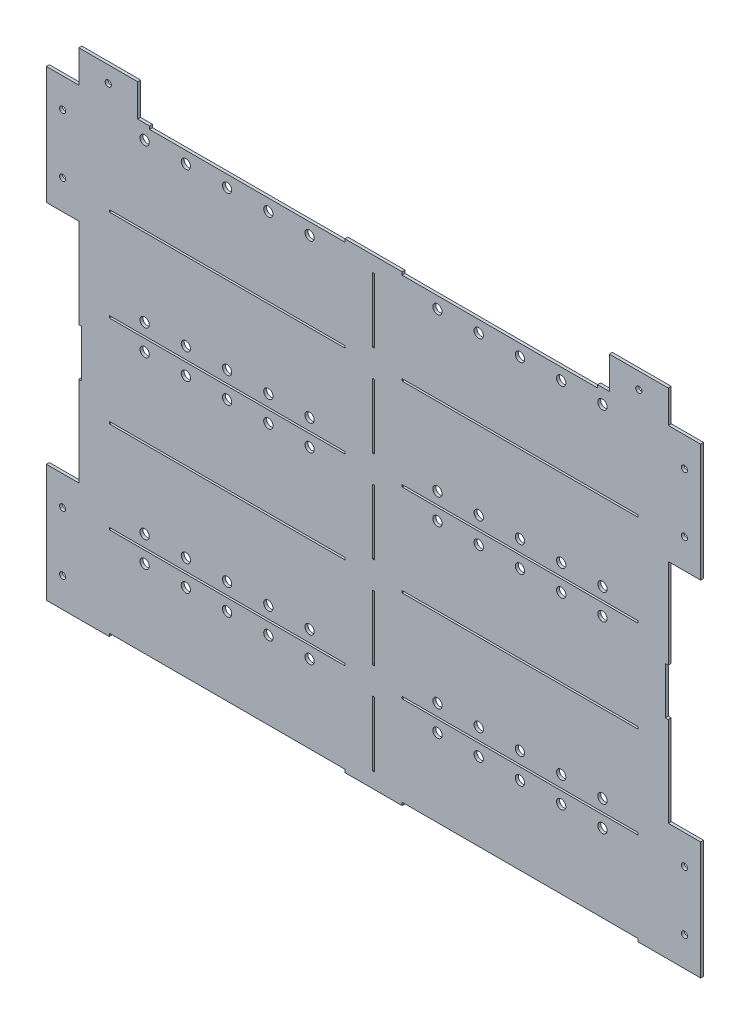
from build123d import *

# Parameters (mm, degrees)
MASTER_SKETCH_W            = 635.3556
MASTER_SKETCH_H            = 498.348
BOSS_EXTRUDE1_DEPTH        = 3.175
SKETCH2_W                  = 34.925
SKETCH2_H                  = 127
BOSS_EXTRUDE2_DEPTH        = 3.175
M6_CLEARANCE_HOLE1_D       = 6.6
MIRROR7_COPY_1_SKETCH_W    = 34.925
MIRROR7_COPY_1_SKETCH_H    = 127
MIRROR7_COPY_1_DEPTH       = 3.175
MIRROR7_COPY_2_D           = 6.6
SKETCH5_W                  = 2.286
SKETCH5_H                  = 69.85
CUT_EXTRUDE1_DEPTH         = 432.771348596
LPATTERN1_COUNT            = 5
LPATTERN1_PITCH            = 98.8568
SKETCH7_W                  = 254
SKETCH7_H                  = 2.286
CUT_EXTRUDE3_DEPTH         = 432.771348596
LPATTERN2_COUNT            = 4
LPATTERN2_PITCH            = 98.8568
MIRROR4_COPY_1_SKETCH_W    = 254
MIRROR4_COPY_1_SKETCH_H    = 2.286
MIRROR4_COPY_1_DEPTH       = 432.771348596
MIRROR4_COPY_2_SKETCH_W    = 254
MIRROR4_COPY_2_SKETCH_H    = 2.286
MIRROR4_COPY_2_DEPTH       = 432.771348596
MIRROR4_COPY_3_SKETCH_W    = 254
MIRROR4_COPY_3_SKETCH_H    = 2.286
MIRROR4_COPY_3_DEPTH       = 432.771348596
SKETCH10_W                 = 63.5
SKETCH10_H                 = 34.925
SKETCH10_R                 = 3
BOSS_EXTRUDE3_DEPTH        = 3.175
M6_CLEARANCE_HOLE2_D       = 6.6
SKETCH6_W                  = 254
SKETCH6_H                  = 3.175
SKETCH6_W_2                = 210.6549
CUT_EXTRUDE2_DEPTH         = 453.825636414
SKETCH15_W                 = 6.35
SKETCH15_H                 = 50.8
CUT_EXTRUDE4_DEPTH         = 453.825636414
SKETCH16_R                 = 5
CUT_EXTRUDE5_DEPTH         = 453.825636414
LPATTERN3_COUNT            = 3
LPATTERN3_PITCH            = 44.45
LPATTERN3_COL_COUNT        = 3
LPATTERN3_COL_PITCH        = 44.45
MIRROR9_COPY_1_SKETCH_R    = 5
MIRROR9_COPY_1_DEPTH       = 453.825636414
MIRROR9_COPY_2_SKETCH_R    = 5
MIRROR9_COPY_2_DEPTH       = 453.825636414
MIRROR9_COPY_3_SKETCH_R    = 5
MIRROR9_COPY_3_DEPTH       = 453.825636414
MIRROR9_COPY_4_SKETCH_R    = 5
MIRROR9_COPY_4_DEPTH       = 453.825636414
MIRROR10_COPY_1_SKETCH_R   = 5
MIRROR10_COPY_1_DEPTH      = 453.825636414
MIRROR10_COPY_2_SKETCH_R   = 5
MIRROR10_COPY_2_DEPTH      = 453.825636414
MIRROR10_COPY_3_SKETCH_R   = 5
MIRROR10_COPY_3_DEPTH      = 453.825636414
MIRROR10_COPY_4_SKETCH_R   = 5
MIRROR10_COPY_4_DEPTH      = 453.825636414
MIRROR10_COPY_5_SKETCH_R   = 5
MIRROR10_COPY_5_DEPTH      = 453.825636414
MIRROR10_COPY_6_SKETCH_R   = 5
MIRROR10_COPY_6_DEPTH      = 453.825636414
MIRROR10_COPY_7_SKETCH_R   = 5
MIRROR10_COPY_7_DEPTH      = 453.825636414
MIRROR10_COPY_8_SKETCH_R   = 5
MIRROR10_COPY_8_DEPTH      = 453.825636414
MIRROR10_COPY_9_SKETCH_R   = 5
MIRROR10_COPY_9_DEPTH      = 453.825636414
LPATTERN4_COUNT            = 2
LPATTERN4_PITCH            = 395.4272
LPATTERN4_COPY_1_SKETCH_R  = 5
LPATTERN4_COPY_1_DEPTH     = 453.825636414
LPATTERN4_COPY_2_SKETCH_R  = 5
LPATTERN4_COPY_2_DEPTH     = 453.825636414
LPATTERN4_COPY_3_SKETCH_R  = 5
LPATTERN4_COPY_3_DEPTH     = 453.825636414
LPATTERN4_COPY_4_SKETCH_R  = 5
LPATTERN4_COPY_4_DEPTH     = 453.825636414
LPATTERN4_COPY_5_SKETCH_R  = 5
LPATTERN4_COPY_5_DEPTH     = 453.825636414
LPATTERN4_COPY_6_SKETCH_R  = 5
LPATTERN4_COPY_6_DEPTH     = 453.825636414
LPATTERN4_COPY_7_SKETCH_R  = 5
LPATTERN4_COPY_7_DEPTH     = 453.825636414
LPATTERN4_COPY_8_SKETCH_R  = 5
LPATTERN4_COPY_8_DEPTH     = 453.825636414
LPATTERN4_COPY_9_SKETCH_R  = 5
LPATTERN4_COPY_9_DEPTH     = 453.825636414
LPATTERN6_COUNT            = 2
LPATTERN6_PITCH            = 197.7136
LPATTERN6_COPY_1_SKETCH_R  = 5
LPATTERN6_COPY_1_DEPTH     = 453.825636414
LPATTERN6_COPY_2_SKETCH_R  = 5
LPATTERN6_COPY_2_DEPTH     = 453.825636414
LPATTERN6_COPY_3_SKETCH_R  = 5
LPATTERN6_COPY_3_DEPTH     = 453.825636414
LPATTERN6_COPY_4_SKETCH_R  = 5
LPATTERN6_COPY_4_DEPTH     = 453.825636414
LPATTERN6_COPY_5_SKETCH_R  = 5
LPATTERN6_COPY_5_DEPTH     = 453.825636414
LPATTERN6_COPY_6_SKETCH_R  = 5
LPATTERN6_COPY_6_DEPTH     = 453.825636414
LPATTERN6_COPY_7_SKETCH_R  = 5
LPATTERN6_COPY_7_DEPTH     = 453.825636414
LPATTERN6_COPY_8_SKETCH_R  = 5
LPATTERN6_COPY_8_DEPTH     = 453.825636414
LPATTERN6_COPY_9_SKETCH_R  = 5
LPATTERN6_COPY_9_DEPTH     = 453.825636414
LPATTERN6_COPY_10_SKETCH_R = 5
LPATTERN6_COPY_10_DEPTH    = 453.825636414
LPATTERN6_COPY_11_SKETCH_R = 5
LPATTERN6_COPY_11_DEPTH    = 453.825636414
LPATTERN6_COPY_12_SKETCH_R = 5
LPATTERN6_COPY_12_DEPTH    = 453.825636414
LPATTERN6_COPY_13_SKETCH_R = 5
LPATTERN6_COPY_13_DEPTH    = 453.825636414
LPATTERN6_COPY_14_SKETCH_R = 5
LPATTERN6_COPY_14_DEPTH    = 453.825636414
LPATTERN6_COPY_15_SKETCH_R = 5
LPATTERN6_COPY_15_DEPTH    = 453.825636414
LPATTERN6_COPY_16_SKETCH_R = 5
LPATTERN6_COPY_16_DEPTH    = 453.825636414
LPATTERN6_COPY_17_SKETCH_R = 5
LPATTERN6_COPY_17_DEPTH    = 453.825636414
LPATTERN6_COPY_18_SKETCH_R = 5
LPATTERN6_COPY_18_DEPTH    = 453.825636414
LPATTERN6_COPY_19_SKETCH_R = 5
LPATTERN6_COPY_19_DEPTH    = 453.825636414


with BuildPart() as part:
    # Master Sketch → Boss-Extrude1 (new body)
    with BuildSketch(Plane.XY):
        Rectangle(MASTER_SKETCH_W, MASTER_SKETCH_H)
    extrude(amount=BOSS_EXTRUDE1_DEPTH)

    # Sketch2 → Boss-Extrude2 (add)
    with BuildSketch(Plane.XY.offset(3.175)):
        with Locations((-335.1403, -185.674)):
            Rectangle(SKETCH2_W, SKETCH2_H)
    boss_extrude2 = extrude(amount=-BOSS_EXTRUDE2_DEPTH)

    # M6 Clearance Hole1 (through all)
    with Locations(Plane.XY.offset(3.175)):
        with Locations((-335.1403, -217.424), (-335.1403, -153.924)):
            m6_clearance_hole1 = Hole(M6_CLEARANCE_HOLE1_D / 2)

    # Mirror1: Boss-Extrude2, M6 Clearance Hole1 across plane
    add(boss_extrude2.mirror(Plane(origin=(0, 0, 0), x_dir=(0, 0, 1), z_dir=(1, 0, 0))))
    add(m6_clearance_hole1.mirror(Plane(origin=(0, 0, 0), x_dir=(0, 0, 1), z_dir=(1, 0, 0))), mode=Mode.SUBTRACT)

    # Mirror7: Boss-Extrude2, M6 Clearance Hole1 across plane
    add(boss_extrude2.mirror(Plane.ZX))
    add(m6_clearance_hole1.mirror(Plane.ZX), mode=Mode.SUBTRACT)

    # Mirror7 copy 1 sketch → Mirror7 copy 1 (add)
    with BuildSketch(Plane(origin=(0, 0, 3.175), x_dir=(-1, 0, 0), z_dir=(0, 0, 1))):
        with Locations((-335.1403, -185.674)):
            Rectangle(MIRROR7_COPY_1_SKETCH_W, MIRROR7_COPY_1_SKETCH_H)
    extrude(amount=-MIRROR7_COPY_1_DEPTH)

    # Mirror7 copy 2 (through all)
    with Locations(Plane(origin=(0, 0, 3.175), x_dir=(-1, 0, 0), z_dir=(0, 0, 1))):
        with Locations((-335.1403, -217.424), (-335.1403, -153.924)):
            Hole(MIRROR7_COPY_2_D / 2)

    # Sketch5 → Cut-Extrude1 (cut, through all)
    with BuildSketch(Plane.XY.offset(3.175)):
        with Locations((0, 197.7136)):
            Rectangle(SKETCH5_W, SKETCH5_H)
    cut_extrude1 = extrude(amount=-CUT_EXTRUDE1_DEPTH, mode=Mode.SUBTRACT)

    # LPattern1: Cut-Extrude1 ×5
    with Locations(*[(0, -i * LPATTERN1_PITCH, 0) for i in range(1, LPATTERN1_COUNT)]):
        add(cut_extrude1, mode=Mode.SUBTRACT)

    # Sketch7 → Cut-Extrude3 (cut, through all)
    with BuildSketch(Plane.XY.offset(3.175)):
        with Locations((-157.8229, 148.2852)):
            Rectangle(SKETCH7_W, SKETCH7_H)
    cut_extrude3 = extrude(amount=-CUT_EXTRUDE3_DEPTH, mode=Mode.SUBTRACT)

    # LPattern2: Cut-Extrude3 ×4
    with Locations(*[(0, -i * LPATTERN2_PITCH, 0) for i in range(1, LPATTERN2_COUNT)]):
        add(cut_extrude3, mode=Mode.SUBTRACT)

    # Mirror4: Cut-Extrude3 across plane
    add(cut_extrude3.mirror(Plane(origin=(0, 0, 0), x_dir=(0, 0, 1), z_dir=(1, 0, 0))), mode=Mode.SUBTRACT)

    # Mirror4 copy 1 sketch → Mirror4 copy 1 (cut, through all)
    with BuildSketch(Plane(origin=(0, -98.8568, 3.175), x_dir=(-1, 0, 0), z_dir=(0, 0, 1))):
        with Locations((-157.8229, -148.2852)):
            Rectangle(MIRROR4_COPY_1_SKETCH_W, MIRROR4_COPY_1_SKETCH_H)
    extrude(amount=-MIRROR4_COPY_1_DEPTH, mode=Mode.SUBTRACT)

    # Mirror4 copy 2 sketch → Mirror4 copy 2 (cut, through all)
    with BuildSketch(Plane(origin=(0, -197.7136, 3.175), x_dir=(-1, 0, 0), z_dir=(0, 0, 1))):
        with Locations((-157.8229, -148.2852)):
            Rectangle(MIRROR4_COPY_2_SKETCH_W, MIRROR4_COPY_2_SKETCH_H)
    extrude(amount=-MIRROR4_COPY_2_DEPTH, mode=Mode.SUBTRACT)

    # Mirror4 copy 3 sketch → Mirror4 copy 3 (cut, through all)
    with BuildSketch(Plane(origin=(0, -296.5704, 3.175), x_dir=(-1, 0, 0), z_dir=(0, 0, 1))):
        with Locations((-157.8229, -148.2852)):
            Rectangle(MIRROR4_COPY_3_SKETCH_W, MIRROR4_COPY_3_SKETCH_H)
    extrude(amount=-MIRROR4_COPY_3_DEPTH, mode=Mode.SUBTRACT)

    # Sketch10 → Boss-Extrude3 (add)
    with BuildSketch(Plane.XY.offset(3.175)):
        with Locations((-285.9278, 266.6365)):
            Rectangle(SKETCH10_W, SKETCH10_H)
        with Locations((-285.9278, 266.6365)):
            Circle(SKETCH10_R, mode=Mode.SUBTRACT)
    boss_extrude3 = extrude(amount=-BOSS_EXTRUDE3_DEPTH)

    # M6 Clearance Hole2 (through all)
    with Locations(Plane.XY.offset(3.175)):
        with Locations((-285.9278, 266.6365)):
            m6_clearance_hole2 = Hole(M6_CLEARANCE_HOLE2_D / 2)

    # Mirror6: Boss-Extrude3, M6 Clearance Hole2 across plane
    add(boss_extrude3.mirror(Plane(origin=(0, 0, 0), x_dir=(0, 0, 1), z_dir=(1, 0, 0))))
    add(m6_clearance_hole2.mirror(Plane(origin=(0, 0, 0), x_dir=(0, 0, 1), z_dir=(1, 0, 0))), mode=Mode.SUBTRACT)

    # Sketch6 → Cut-Extrude2 (cut, through all)
    with BuildSketch(Plane.XY.offset(3.175)):
        with Locations((-157.8229, -247.5865)):
            Rectangle(SKETCH6_W, SKETCH6_H)
        with Locations((157.8229, -247.5865)):
            Rectangle(SKETCH6_W, SKETCH6_H)
        with Locations((-136.15035, 247.5865)):
            Rectangle(SKETCH6_W_2, SKETCH6_H)
        with Locations((136.15035, 247.5865)):
            Rectangle(SKETCH6_W_2, SKETCH6_H)
    extrude(amount=-CUT_EXTRUDE2_DEPTH, mode=Mode.SUBTRACT)

    # Sketch15 → Cut-Extrude4 (cut, through all)
    with BuildSketch(Plane(origin=(0, 0, 0), x_dir=(-1, 0, 0), z_dir=(0, 0, -1))):
        with Locations((317.6778, 0)):
            Rectangle(SKETCH15_W, SKETCH15_H)
    cut_extrude4 = extrude(amount=-CUT_EXTRUDE4_DEPTH, mode=Mode.SUBTRACT)

    # Mirror8: Cut-Extrude4 across plane
    add(cut_extrude4.mirror(Plane(origin=(0, 0, 0), x_dir=(0, 0, 1), z_dir=(1, 0, 0))), mode=Mode.SUBTRACT)

    # Sketch16 → Cut-Extrude5 (cut, through all)
    with BuildSketch(Plane(origin=(0, 0, 0), x_dir=(-1, 0, 0), z_dir=(0, 0, -1))):
        with Locations((-157.8229, -162.1282)):
            Circle(SKETCH16_R)
    cut_extrude5 = extrude(amount=-CUT_EXTRUDE5_DEPTH, mode=Mode.SUBTRACT)

    # LPattern3: Cut-Extrude5 ×3
    with Locations(*[(i * LPATTERN3_PITCH, 0, 0) for i in range(1, LPATTERN3_COUNT)]):
        add(cut_extrude5, mode=Mode.SUBTRACT)

    # LPattern3 col: Cut-Extrude5 ×3
    with Locations(*[(-i * LPATTERN3_COL_PITCH, 0, 0) for i in range(1, LPATTERN3_COL_COUNT)]):
        add(cut_extrude5, mode=Mode.SUBTRACT)

    # Mirror9: Cut-Extrude5 across plane
    add(cut_extrude5.mirror(Plane(origin=(0, 0, 0), x_dir=(0, 0, 1), z_dir=(1, 0, 0))), mode=Mode.SUBTRACT)

    # Mirror9 copy 1 sketch → Mirror9 copy 1 (cut, through all)
    with BuildSketch(Plane(origin=(-44.45, 0, 0), x_dir=(1, 0, 0), z_dir=(0, 0, -1))):
        with Locations((-157.8229, 162.1282)):
            Circle(MIRROR9_COPY_1_SKETCH_R)
    extrude(amount=-MIRROR9_COPY_1_DEPTH, mode=Mode.SUBTRACT)

    # Mirror9 copy 2 sketch → Mirror9 copy 2 (cut, through all)
    with BuildSketch(Plane(origin=(-88.9, 0, 0), x_dir=(1, 0, 0), z_dir=(0, 0, -1))):
        with Locations((-157.8229, 162.1282)):
            Circle(MIRROR9_COPY_2_SKETCH_R)
    extrude(amount=-MIRROR9_COPY_2_DEPTH, mode=Mode.SUBTRACT)

    # Mirror9 copy 3 sketch → Mirror9 copy 3 (cut, through all)
    with BuildSketch(Plane(origin=(44.45, 0, 0), x_dir=(1, 0, 0), z_dir=(0, 0, -1))):
        with Locations((-157.8229, 162.1282)):
            Circle(MIRROR9_COPY_3_SKETCH_R)
    extrude(amount=-MIRROR9_COPY_3_DEPTH, mode=Mode.SUBTRACT)

    # Mirror9 copy 4 sketch → Mirror9 copy 4 (cut, through all)
    with BuildSketch(Plane(origin=(88.9, 0, 0), x_dir=(1, 0, 0), z_dir=(0, 0, -1))):
        with Locations((-157.8229, 162.1282)):
            Circle(MIRROR9_COPY_4_SKETCH_R)
    extrude(amount=-MIRROR9_COPY_4_DEPTH, mode=Mode.SUBTRACT)

    # Mirror10: Cut-Extrude5 across plane
    add(cut_extrude5.mirror(Plane.ZX.offset(-148.2852)), mode=Mode.SUBTRACT)

    # Mirror10 copy 1 sketch → Mirror10 copy 1 (cut, through all)
    with BuildSketch(Plane(origin=(44.45, -296.5704, 0), x_dir=(-1, 0, 0), z_dir=(0, 0, -1))):
        with Locations((-157.8229, 162.1282)):
            Circle(MIRROR10_COPY_1_SKETCH_R)
    extrude(amount=-MIRROR10_COPY_1_DEPTH, mode=Mode.SUBTRACT)

    # Mirror10 copy 2 sketch → Mirror10 copy 2 (cut, through all)
    with BuildSketch(Plane(origin=(88.9, -296.5704, 0), x_dir=(-1, 0, 0), z_dir=(0, 0, -1))):
        with Locations((-157.8229, 162.1282)):
            Circle(MIRROR10_COPY_2_SKETCH_R)
    extrude(amount=-MIRROR10_COPY_2_DEPTH, mode=Mode.SUBTRACT)

    # Mirror10 copy 3 sketch → Mirror10 copy 3 (cut, through all)
    with BuildSketch(Plane(origin=(-44.45, -296.5704, 0), x_dir=(-1, 0, 0), z_dir=(0, 0, -1))):
        with Locations((-157.8229, 162.1282)):
            Circle(MIRROR10_COPY_3_SKETCH_R)
    extrude(amount=-MIRROR10_COPY_3_DEPTH, mode=Mode.SUBTRACT)

    # Mirror10 copy 4 sketch → Mirror10 copy 4 (cut, through all)
    with BuildSketch(Plane(origin=(-88.9, -296.5704, 0), x_dir=(-1, 0, 0), z_dir=(0, 0, -1))):
        with Locations((-157.8229, 162.1282)):
            Circle(MIRROR10_COPY_4_SKETCH_R)
    extrude(amount=-MIRROR10_COPY_4_DEPTH, mode=Mode.SUBTRACT)

    # Mirror10 copy 5 sketch → Mirror10 copy 5 (cut, through all)
    with BuildSketch(Plane(origin=(0, -296.5704, 0), x_dir=(1, 0, 0), z_dir=(0, 0, -1))):
        with Locations((-157.8229, -162.1282)):
            Circle(MIRROR10_COPY_5_SKETCH_R)
    extrude(amount=-MIRROR10_COPY_5_DEPTH, mode=Mode.SUBTRACT)

    # Mirror10 copy 6 sketch → Mirror10 copy 6 (cut, through all)
    with BuildSketch(Plane(origin=(-44.45, -296.5704, 0), x_dir=(1, 0, 0), z_dir=(0, 0, -1))):
        with Locations((-157.8229, -162.1282)):
            Circle(MIRROR10_COPY_6_SKETCH_R)
    extrude(amount=-MIRROR10_COPY_6_DEPTH, mode=Mode.SUBTRACT)

    # Mirror10 copy 7 sketch → Mirror10 copy 7 (cut, through all)
    with BuildSketch(Plane(origin=(-88.9, -296.5704, 0), x_dir=(1, 0, 0), z_dir=(0, 0, -1))):
        with Locations((-157.8229, -162.1282)):
            Circle(MIRROR10_COPY_7_SKETCH_R)
    extrude(amount=-MIRROR10_COPY_7_DEPTH, mode=Mode.SUBTRACT)

    # Mirror10 copy 8 sketch → Mirror10 copy 8 (cut, through all)
    with BuildSketch(Plane(origin=(44.45, -296.5704, 0), x_dir=(1, 0, 0), z_dir=(0, 0, -1))):
        with Locations((-157.8229, -162.1282)):
            Circle(MIRROR10_COPY_8_SKETCH_R)
    extrude(amount=-MIRROR10_COPY_8_DEPTH, mode=Mode.SUBTRACT)

    # Mirror10 copy 9 sketch → Mirror10 copy 9 (cut, through all)
    with BuildSketch(Plane(origin=(88.9, -296.5704, 0), x_dir=(1, 0, 0), z_dir=(0, 0, -1))):
        with Locations((-157.8229, -162.1282)):
            Circle(MIRROR10_COPY_9_SKETCH_R)
    extrude(amount=-MIRROR10_COPY_9_DEPTH, mode=Mode.SUBTRACT)

    # LPattern4: Cut-Extrude5 ×2
    with Locations(*[(0, i * LPATTERN4_PITCH, 0) for i in range(1, LPATTERN4_COUNT)]):
        add(cut_extrude5, mode=Mode.SUBTRACT)

    # LPattern4 copy 1 sketch → LPattern4 copy 1 (cut, through all)
    with BuildSketch(Plane(origin=(44.45, 395.4272, 0), x_dir=(-1, 0, 0), z_dir=(0, 0, -1))):
        with Locations((-157.8229, -162.1282)):
            Circle(LPATTERN4_COPY_1_SKETCH_R)
    extrude(amount=-LPATTERN4_COPY_1_DEPTH, mode=Mode.SUBTRACT)

    # LPattern4 copy 2 sketch → LPattern4 copy 2 (cut, through all)
    with BuildSketch(Plane(origin=(88.9, 395.4272, 0), x_dir=(-1, 0, 0), z_dir=(0, 0, -1))):
        with Locations((-157.8229, -162.1282)):
            Circle(LPATTERN4_COPY_2_SKETCH_R)
    extrude(amount=-LPATTERN4_COPY_2_DEPTH, mode=Mode.SUBTRACT)

    # LPattern4 copy 3 sketch → LPattern4 copy 3 (cut, through all)
    with BuildSketch(Plane(origin=(-44.45, 395.4272, 0), x_dir=(-1, 0, 0), z_dir=(0, 0, -1))):
        with Locations((-157.8229, -162.1282)):
            Circle(LPATTERN4_COPY_3_SKETCH_R)
    extrude(amount=-LPATTERN4_COPY_3_DEPTH, mode=Mode.SUBTRACT)

    # LPattern4 copy 4 sketch → LPattern4 copy 4 (cut, through all)
    with BuildSketch(Plane(origin=(-88.9, 395.4272, 0), x_dir=(-1, 0, 0), z_dir=(0, 0, -1))):
        with Locations((-157.8229, -162.1282)):
            Circle(LPATTERN4_COPY_4_SKETCH_R)
    extrude(amount=-LPATTERN4_COPY_4_DEPTH, mode=Mode.SUBTRACT)

    # LPattern4 copy 5 sketch → LPattern4 copy 5 (cut, through all)
    with BuildSketch(Plane(origin=(0, 395.4272, 0), x_dir=(1, 0, 0), z_dir=(0, 0, -1))):
        with Locations((-157.8229, 162.1282)):
            Circle(LPATTERN4_COPY_5_SKETCH_R)
    extrude(amount=-LPATTERN4_COPY_5_DEPTH, mode=Mode.SUBTRACT)

    # LPattern4 copy 6 sketch → LPattern4 copy 6 (cut, through all)
    with BuildSketch(Plane(origin=(-44.45, 395.4272, 0), x_dir=(1, 0, 0), z_dir=(0, 0, -1))):
        with Locations((-157.8229, 162.1282)):
            Circle(LPATTERN4_COPY_6_SKETCH_R)
    extrude(amount=-LPATTERN4_COPY_6_DEPTH, mode=Mode.SUBTRACT)

    # LPattern4 copy 7 sketch → LPattern4 copy 7 (cut, through all)
    with BuildSketch(Plane(origin=(-88.9, 395.4272, 0), x_dir=(1, 0, 0), z_dir=(0, 0, -1))):
        with Locations((-157.8229, 162.1282)):
            Circle(LPATTERN4_COPY_7_SKETCH_R)
    extrude(amount=-LPATTERN4_COPY_7_DEPTH, mode=Mode.SUBTRACT)

    # LPattern4 copy 8 sketch → LPattern4 copy 8 (cut, through all)
    with BuildSketch(Plane(origin=(44.45, 395.4272, 0), x_dir=(1, 0, 0), z_dir=(0, 0, -1))):
        with Locations((-157.8229, 162.1282)):
            Circle(LPATTERN4_COPY_8_SKETCH_R)
    extrude(amount=-LPATTERN4_COPY_8_DEPTH, mode=Mode.SUBTRACT)

    # LPattern4 copy 9 sketch → LPattern4 copy 9 (cut, through all)
    with BuildSketch(Plane(origin=(88.9, 395.4272, 0), x_dir=(1, 0, 0), z_dir=(0, 0, -1))):
        with Locations((-157.8229, 162.1282)):
            Circle(LPATTERN4_COPY_9_SKETCH_R)
    extrude(amount=-LPATTERN4_COPY_9_DEPTH, mode=Mode.SUBTRACT)

    # LPattern6: Cut-Extrude5 ×2
    with Locations(*[(0, i * LPATTERN6_PITCH, 0) for i in range(1, LPATTERN6_COUNT)]):
        add(cut_extrude5, mode=Mode.SUBTRACT)

    # LPattern6 copy 1 sketch → LPattern6 copy 1 (cut, through all)
    with BuildSketch(Plane(origin=(44.45, 197.7136, 0), x_dir=(-1, 0, 0), z_dir=(0, 0, -1))):
        with Locations((-157.8229, -162.1282)):
            Circle(LPATTERN6_COPY_1_SKETCH_R)
    extrude(amount=-LPATTERN6_COPY_1_DEPTH, mode=Mode.SUBTRACT)

    # LPattern6 copy 2 sketch → LPattern6 copy 2 (cut, through all)
    with BuildSketch(Plane(origin=(88.9, 197.7136, 0), x_dir=(-1, 0, 0), z_dir=(0, 0, -1))):
        with Locations((-157.8229, -162.1282)):
            Circle(LPATTERN6_COPY_2_SKETCH_R)
    extrude(amount=-LPATTERN6_COPY_2_DEPTH, mode=Mode.SUBTRACT)

    # LPattern6 copy 3 sketch → LPattern6 copy 3 (cut, through all)
    with BuildSketch(Plane(origin=(-44.45, 197.7136, 0), x_dir=(-1, 0, 0), z_dir=(0, 0, -1))):
        with Locations((-157.8229, -162.1282)):
            Circle(LPATTERN6_COPY_3_SKETCH_R)
    extrude(amount=-LPATTERN6_COPY_3_DEPTH, mode=Mode.SUBTRACT)

    # LPattern6 copy 4 sketch → LPattern6 copy 4 (cut, through all)
    with BuildSketch(Plane(origin=(-88.9, 197.7136, 0), x_dir=(-1, 0, 0), z_dir=(0, 0, -1))):
        with Locations((-157.8229, -162.1282)):
            Circle(LPATTERN6_COPY_4_SKETCH_R)
    extrude(amount=-LPATTERN6_COPY_4_DEPTH, mode=Mode.SUBTRACT)

    # LPattern6 copy 5 sketch → LPattern6 copy 5 (cut, through all)
    with BuildSketch(Plane(origin=(0, 197.7136, 0), x_dir=(1, 0, 0), z_dir=(0, 0, -1))):
        with Locations((-157.8229, 162.1282)):
            Circle(LPATTERN6_COPY_5_SKETCH_R)
    extrude(amount=-LPATTERN6_COPY_5_DEPTH, mode=Mode.SUBTRACT)

    # LPattern6 copy 6 sketch → LPattern6 copy 6 (cut, through all)
    with BuildSketch(Plane(origin=(-44.45, 197.7136, 0), x_dir=(1, 0, 0), z_dir=(0, 0, -1))):
        with Locations((-157.8229, 162.1282)):
            Circle(LPATTERN6_COPY_6_SKETCH_R)
    extrude(amount=-LPATTERN6_COPY_6_DEPTH, mode=Mode.SUBTRACT)

    # LPattern6 copy 7 sketch → LPattern6 copy 7 (cut, through all)
    with BuildSketch(Plane(origin=(-88.9, 197.7136, 0), x_dir=(1, 0, 0), z_dir=(0, 0, -1))):
        with Locations((-157.8229, 162.1282)):
            Circle(LPATTERN6_COPY_7_SKETCH_R)
    extrude(amount=-LPATTERN6_COPY_7_DEPTH, mode=Mode.SUBTRACT)

    # LPattern6 copy 8 sketch → LPattern6 copy 8 (cut, through all)
    with BuildSketch(Plane(origin=(44.45, 197.7136, 0), x_dir=(1, 0, 0), z_dir=(0, 0, -1))):
        with Locations((-157.8229, 162.1282)):
            Circle(LPATTERN6_COPY_8_SKETCH_R)
    extrude(amount=-LPATTERN6_COPY_8_DEPTH, mode=Mode.SUBTRACT)

    # LPattern6 copy 9 sketch → LPattern6 copy 9 (cut, through all)
    with BuildSketch(Plane(origin=(88.9, 197.7136, 0), x_dir=(1, 0, 0), z_dir=(0, 0, -1))):
        with Locations((-157.8229, 162.1282)):
            Circle(LPATTERN6_COPY_9_SKETCH_R)
    extrude(amount=-LPATTERN6_COPY_9_DEPTH, mode=Mode.SUBTRACT)

    # LPattern6 copy 10 sketch → LPattern6 copy 10 (cut, through all)
    with BuildSketch(Plane(origin=(0, -98.8568, 0), x_dir=(-1, 0, 0), z_dir=(0, 0, -1))):
        with Locations((-157.8229, 162.1282)):
            Circle(LPATTERN6_COPY_10_SKETCH_R)
    extrude(amount=-LPATTERN6_COPY_10_DEPTH, mode=Mode.SUBTRACT)

    # LPattern6 copy 11 sketch → LPattern6 copy 11 (cut, through all)
    with BuildSketch(Plane(origin=(44.45, -98.8568, 0), x_dir=(-1, 0, 0), z_dir=(0, 0, -1))):
        with Locations((-157.8229, 162.1282)):
            Circle(LPATTERN6_COPY_11_SKETCH_R)
    extrude(amount=-LPATTERN6_COPY_11_DEPTH, mode=Mode.SUBTRACT)

    # LPattern6 copy 12 sketch → LPattern6 copy 12 (cut, through all)
    with BuildSketch(Plane(origin=(88.9, -98.8568, 0), x_dir=(-1, 0, 0), z_dir=(0, 0, -1))):
        with Locations((-157.8229, 162.1282)):
            Circle(LPATTERN6_COPY_12_SKETCH_R)
    extrude(amount=-LPATTERN6_COPY_12_DEPTH, mode=Mode.SUBTRACT)

    # LPattern6 copy 13 sketch → LPattern6 copy 13 (cut, through all)
    with BuildSketch(Plane(origin=(-44.45, -98.8568, 0), x_dir=(-1, 0, 0), z_dir=(0, 0, -1))):
        with Locations((-157.8229, 162.1282)):
            Circle(LPATTERN6_COPY_13_SKETCH_R)
    extrude(amount=-LPATTERN6_COPY_13_DEPTH, mode=Mode.SUBTRACT)

    # LPattern6 copy 14 sketch → LPattern6 copy 14 (cut, through all)
    with BuildSketch(Plane(origin=(-88.9, -98.8568, 0), x_dir=(-1, 0, 0), z_dir=(0, 0, -1))):
        with Locations((-157.8229, 162.1282)):
            Circle(LPATTERN6_COPY_14_SKETCH_R)
    extrude(amount=-LPATTERN6_COPY_14_DEPTH, mode=Mode.SUBTRACT)

    # LPattern6 copy 15 sketch → LPattern6 copy 15 (cut, through all)
    with BuildSketch(Plane(origin=(0, -98.8568, 0), x_dir=(1, 0, 0), z_dir=(0, 0, -1))):
        with Locations((-157.8229, -162.1282)):
            Circle(LPATTERN6_COPY_15_SKETCH_R)
    extrude(amount=-LPATTERN6_COPY_15_DEPTH, mode=Mode.SUBTRACT)

    # LPattern6 copy 16 sketch → LPattern6 copy 16 (cut, through all)
    with BuildSketch(Plane(origin=(-44.45, -98.8568, 0), x_dir=(1, 0, 0), z_dir=(0, 0, -1))):
        with Locations((-157.8229, -162.1282)):
            Circle(LPATTERN6_COPY_16_SKETCH_R)
    extrude(amount=-LPATTERN6_COPY_16_DEPTH, mode=Mode.SUBTRACT)

    # LPattern6 copy 17 sketch → LPattern6 copy 17 (cut, through all)
    with BuildSketch(Plane(origin=(-88.9, -98.8568, 0), x_dir=(1, 0, 0), z_dir=(0, 0, -1))):
        with Locations((-157.8229, -162.1282)):
            Circle(LPATTERN6_COPY_17_SKETCH_R)
    extrude(amount=-LPATTERN6_COPY_17_DEPTH, mode=Mode.SUBTRACT)

    # LPattern6 copy 18 sketch → LPattern6 copy 18 (cut, through all)
    with BuildSketch(Plane(origin=(44.45, -98.8568, 0), x_dir=(1, 0, 0), z_dir=(0, 0, -1))):
        with Locations((-157.8229, -162.1282)):
            Circle(LPATTERN6_COPY_18_SKETCH_R)
    extrude(amount=-LPATTERN6_COPY_18_DEPTH, mode=Mode.SUBTRACT)

    # LPattern6 copy 19 sketch → LPattern6 copy 19 (cut, through all)
    with BuildSketch(Plane(origin=(88.9, -98.8568, 0), x_dir=(1, 0, 0), z_dir=(0, 0, -1))):
        with Locations((-157.8229, -162.1282)):
            Circle(LPATTERN6_COPY_19_SKETCH_R)
    extrude(amount=-LPATTERN6_COPY_19_DEPTH, mode=Mode.SUBTRACT)


solid = part.part
